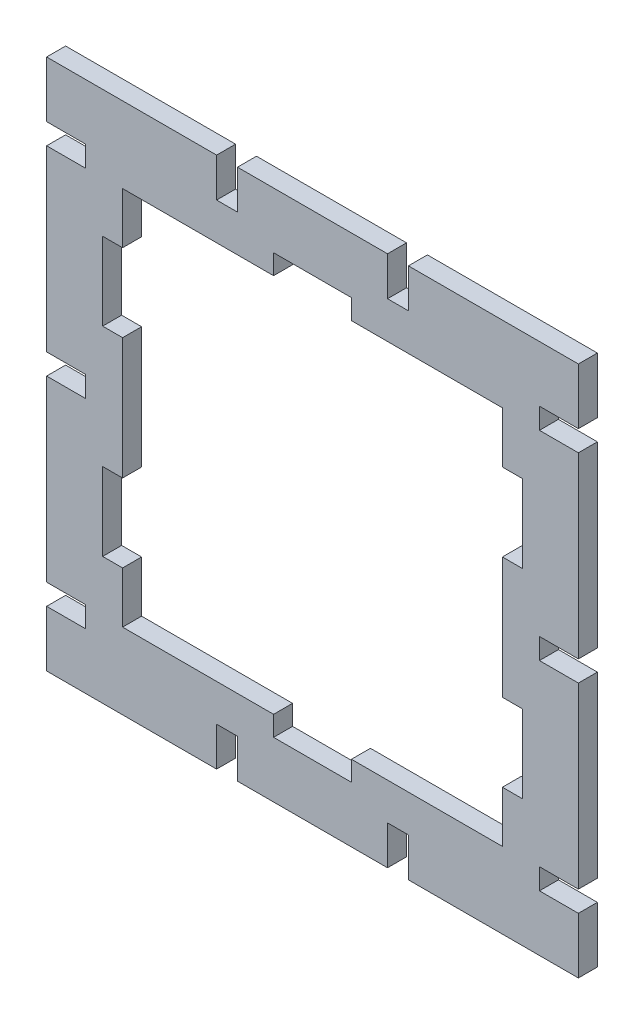
from build123d import *

# Parameters (mm, degrees)
BOSS_EXTRUDE1_DEPTH = 2.5


with BuildPart() as part:
    # Sketch1 → Boss-Extrude1 (new, symmetric)
    with BuildSketch(Plane.XY):
        Polygon((833.545659386, -88.691167375), (833.545659386, -73.941167375), (878.295659386, -73.941167375), (878.295659386, -84.191167375), (883.795659386, -84.191167375), (883.795659386, -73.941167375), (923.295659386, -73.941167375), (923.295659386, -84.191167375), (928.795659386, -84.191167375), (928.795659386, -73.941167375), (973.545659386, -73.941167375), (973.545659386, -88.691167375), (963.295659386, -88.691167375), (963.295659386, -94.191167375), (973.545659386, -94.191167375), (973.545659386, -141.191167375), (963.295659386, -141.191167375), (963.295659386, -146.691167375), (973.545659386, -146.691167375), (973.545659386, -193.691167375), (963.295659386, -193.691167375), (963.295659386, -199.191167375), (973.545659386, -199.191167375), (973.545659386, -213.941167375), (928.795659386, -213.941167375), (928.795659386, -203.691167375), (923.295659386, -203.691167375), (923.295659386, -213.941167375), (883.795659386, -213.941167375), (883.795659386, -203.691167375), (878.295659386, -203.691167375), (878.295659386, -213.941167375), (833.545659386, -213.941167375), (833.545659386, -199.191167375), (843.795659386, -199.191167375), (843.795659386, -193.691167375), (833.545659386, -193.691167375), (833.545659386, -146.691167375), (843.795659386, -146.691167375), (843.795659386, -141.191167375), (833.545659386, -141.191167375), (833.545659386, -94.191167375), (843.795659386, -94.191167375), (843.795659386, -88.691167375), align=None)
        Polygon((893.295659386, -88.691167375), (893.295659386, -93.941167375), (853.545659386, -93.941167375), (853.545659386, -107.441167375), (848.295659386, -107.441167375), (848.295659386, -127.941167375), (853.545659386, -127.941167375), (853.545659386, -159.94119829), (848.295659386, -159.941167375), (848.295659386, -180.441167375), (853.545659386, -180.441167375), (853.545659386, -193.941167375), (893.295659386, -193.941167375), (893.295659386, -199.191167375), (913.795659386, -199.191167375), (913.795659386, -193.941167375), (953.545659386, -193.941167375), (953.545659386, -180.441167375), (958.795659386, -180.441167375), (958.795659386, -159.941167375), (953.545659386, -159.94119829), (953.545659386, -127.941167375), (958.795659386, -127.941167375), (958.795659386, -107.441167375), (953.545659386, -107.441167375), (953.545659386, -93.941167375), (913.795659386, -93.941167375), (913.795659386, -88.691167375), align=None, mode=Mode.SUBTRACT)
    extrude(amount=BOSS_EXTRUDE1_DEPTH, both=True)


solid = part.part
